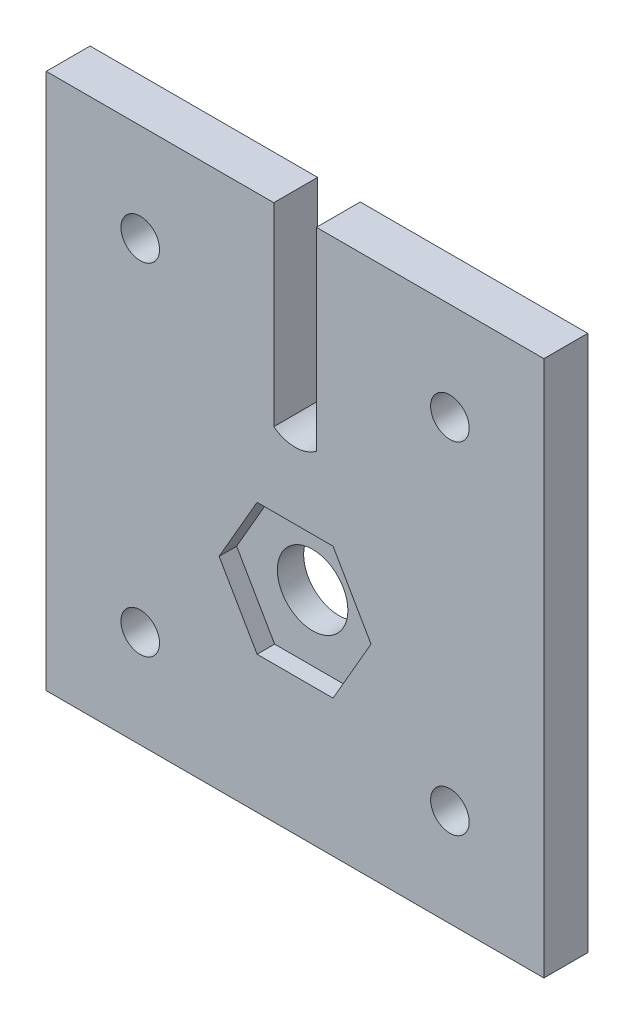
from build123d import *

# Parameters (mm, degrees)
SKETCH1_R           = 2.5527
SKETCH1_R_2         = 1.397
BOSS_EXTRUDE1_DEPTH = 3.175
CUT_EXTRUDE1_DEPTH  = 1.27


with BuildPart() as part:
    # Sketch1 → Boss-Extrude1 (new body)
    with BuildSketch(Plane.XY):
        with BuildLine():
            Line((16.698666352, 5.070945327), (33.168661373, 5.070945327))
            Line((33.168661373, 5.070945327), (33.168661373, -4.903410628))
            Line((33.168661373, -4.903410628), (33.168661373, -8.971340476))
            ThreePointArc((33.168661373, -8.971340476), (34.711147671, -9.490075552), (36.253633968, -8.971340476))
            Line((36.253633968, -8.971340476), (36.253633968, -4.903410628))
            Line((36.253633968, -4.903410628), (36.253633968, 5.070945327))
            Line((36.253633968, 5.070945327), (52.72362899, 5.070945327))
            Line((52.72362899, 5.070945327), (52.72362899, -33.755958849))
            Line((52.72362899, -33.755958849), (16.698666352, -33.755958849))
            Line((16.698666352, -33.755958849), (16.698666352, 5.070945327))
        make_face()
        with Locations((34.711147671, -19.07912216)):
            Circle(SKETCH1_R, mode=Mode.SUBTRACT)
        with Locations((45.918913825, -2.000621413)):
            Circle(SKETCH1_R_2, mode=Mode.SUBTRACT)
        with Locations((23.503381517, -2.000621413)):
            Circle(SKETCH1_R_2, mode=Mode.SUBTRACT)
        with Locations((23.503381517, -26.684392109)):
            Circle(SKETCH1_R_2, mode=Mode.SUBTRACT)
        with Locations((45.918913825, -26.684392109)):
            Circle(SKETCH1_R_2, mode=Mode.SUBTRACT)
    extrude(amount=BOSS_EXTRUDE1_DEPTH)

    # Sketch3 → Cut-Extrude1 (cut)
    with BuildSketch(Plane.XY.offset(3.175)):
        Polygon((40.210408985, -19.07912216), (37.460778328, -14.31662216), (31.961517014, -14.31662216), (29.211886357, -19.07912216), (31.961517014, -23.84162216), (37.460778328, -23.84162216), align=None)
    extrude(amount=-CUT_EXTRUDE1_DEPTH, mode=Mode.SUBTRACT)


solid = part.part
